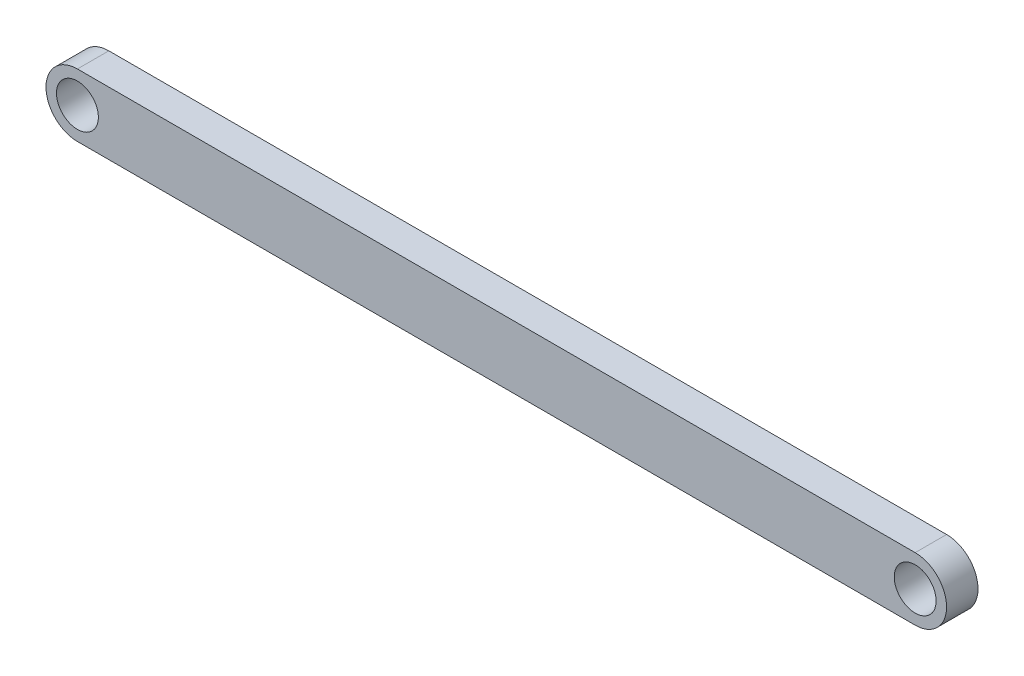
from build123d import *

# Parameters (mm, degrees)
SKETCH1_R      = 10
EXTRUDE1_DEPTH = 15


with BuildPart() as part:
    # Sketch1 → Extrude1 (new body)
    with BuildSketch(Plane.XY):
        with BuildLine():
            Line((-400, 15), (0, 15))
            ThreePointArc((0, 15), (15, 0), (0, -15))
            Line((0, -15), (-400, -15))
            ThreePointArc((-400, -15), (-415, 0), (-400, 15))
        make_face()
        with Locations((-400, 0)):
            Circle(SKETCH1_R, mode=Mode.SUBTRACT)
        Circle(SKETCH1_R, mode=Mode.SUBTRACT)
    extrude(amount=EXTRUDE1_DEPTH)


solid = part.part
